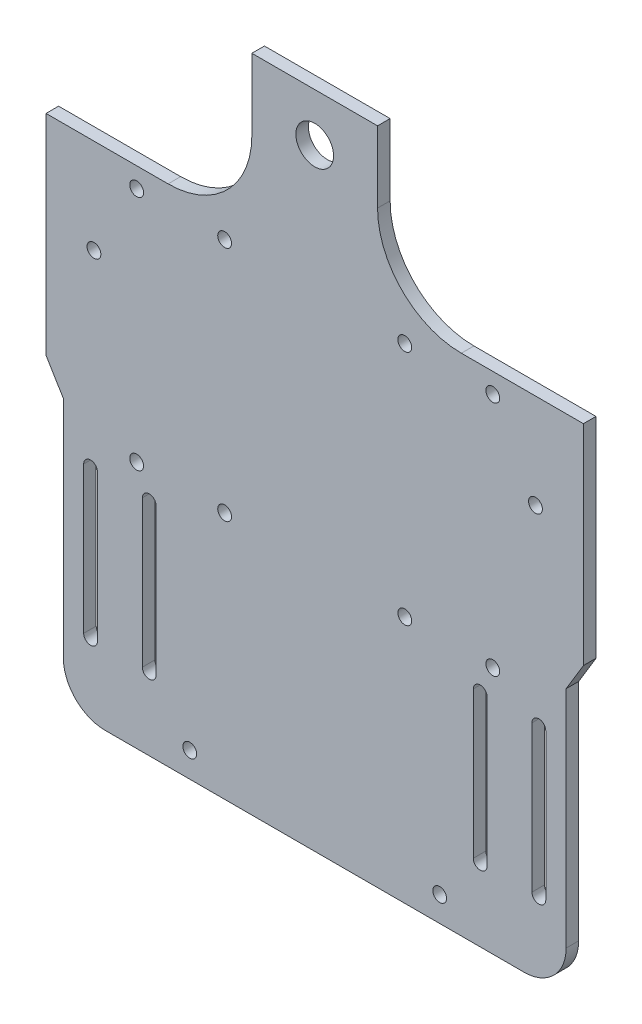
from build123d import *

# Parameters (mm, degrees)
SKETCH1_R           = 4.5
SKETCH1_R_2         = 1.65
BOSS_EXTRUDE1_DEPTH = 3
FILLET3_R           = 20
FILLET4_R           = 10


with BuildPart() as part:
    # Sketch1 → Boss-Extrude1 (new body)
    with BuildSketch(Plane.XY):
        Polygon((402.495772407, 1683.241435849), (402.495772407, 1633.241435849), (406.628072987, 1626.391319652), (406.628072987, 1562.767892621), (526.628072987, 1562.767892621), (526.628072987, 1626.391319652), (530.760373568, 1633.241435849), (530.760373568, 1683.241435849), (481.628072987, 1683.241435849), (481.628072987, 1720.241435849), (451.628072987, 1720.241435849), (451.628072987, 1683.241435849), align=None)
        with Locations((466.628072987, 1708.767892621)):
            Circle(SKETCH1_R, mode=Mode.SUBTRACT)
        with Locations((519.320878863, 1660.655786173)):
            Circle(SKETCH1_R_2, mode=Mode.SUBTRACT)
        with Locations((496.449751686, 1568.767892621)):
            Circle(SKETCH1_R_2, mode=Mode.SUBTRACT)
        with Locations(Location((413.935267112, 1660.655786173, 0), (0, 0, 180))):
            Circle(SKETCH1_R_2, mode=Mode.SUBTRACT)
        with Locations(Location((436.806394289, 1568.767892621, 0), (0, 0, 180))):
            Circle(SKETCH1_R_2, mode=Mode.SUBTRACT)
        with Locations((488.128072987, 1678.491435849)):
            Circle(SKETCH1_R_2, mode=Mode.SUBTRACT)
        with Locations(Location((509.128072987, 1678.491435849, 0), (0, 0, 180))):
            Circle(SKETCH1_R_2, mode=Mode.SUBTRACT)
        with Locations(Location((488.128072987, 1621.991435849, 0), (0, 0, 180))):
            Circle(SKETCH1_R_2, mode=Mode.SUBTRACT)
        with Locations((509.128072987, 1621.991435849)):
            Circle(SKETCH1_R_2, mode=Mode.SUBTRACT)
        with Locations(Location((424.128072987, 1621.991435849, 0), (0, 0, 180))):
            Circle(SKETCH1_R_2, mode=Mode.SUBTRACT)
        with Locations((424.128072987, 1678.491435849)):
            Circle(SKETCH1_R_2, mode=Mode.SUBTRACT)
        with Locations(Location((445.128072987, 1678.491435849, 0), (0, 0, 180))):
            Circle(SKETCH1_R_2, mode=Mode.SUBTRACT)
        with Locations((445.128072987, 1621.991435849)):
            Circle(SKETCH1_R_2, mode=Mode.SUBTRACT)
        with BuildLine():
            Line((414.778072987, 1615.267892621), (414.778072987, 1580.267892621))
            ThreePointArc((414.778072987, 1580.267892621), (413.128072987, 1578.617892621), (411.478072987, 1580.267892621))
            Line((411.478072987, 1580.267892621), (411.478072987, 1615.267892621))
            ThreePointArc((411.478072987, 1615.267892621), (413.128072987, 1616.917892621), (414.778072987, 1615.267892621))
        make_face(mode=Mode.SUBTRACT)
        with BuildLine():
            Line((518.478072987, 1615.267892621), (518.478072987, 1580.267892621))
            ThreePointArc((518.478072987, 1580.267892621), (520.128072987, 1578.617892621), (521.778072987, 1580.267892621))
            Line((521.778072987, 1580.267892621), (521.778072987, 1615.267892621))
            ThreePointArc((521.778072987, 1615.267892621), (520.128072987, 1616.917892621), (518.478072987, 1615.267892621))
        make_face(mode=Mode.SUBTRACT)
        with BuildLine():
            Line((428.778072987, 1615.267892621), (428.778072987, 1580.267892621))
            ThreePointArc((428.778072987, 1580.267892621), (427.128072987, 1578.617892621), (425.478072987, 1580.267892621))
            Line((425.478072987, 1580.267892621), (425.478072987, 1615.267892621))
            ThreePointArc((425.478072987, 1615.267892621), (427.128072987, 1616.917892621), (428.778072987, 1615.267892621))
        make_face(mode=Mode.SUBTRACT)
        with BuildLine():
            Line((504.478072987, 1615.267892621), (504.478072987, 1580.267892621))
            ThreePointArc((504.478072987, 1580.267892621), (506.128072987, 1578.617892621), (507.778072987, 1580.267892621))
            Line((507.778072987, 1580.267892621), (507.778072987, 1615.267892621))
            ThreePointArc((507.778072987, 1615.267892621), (506.128072987, 1616.917892621), (504.478072987, 1615.267892621))
        make_face(mode=Mode.SUBTRACT)
    extrude(amount=BOSS_EXTRUDE1_DEPTH)

    # Fillet3
    fillet3_edges = [part.edges().sort_by_distance(p)[0] for p in [
        (481.628072987, 1683.241435849, 1.5),
        (451.628072987, 1683.241435849, 1.5),
    ]]
    fillet(fillet3_edges, radius=FILLET3_R)

    # Fillet4
    fillet4_edges = [part.edges().sort_by_distance(p)[0] for p in [
        (526.628072987, 1562.767892621, 1.5),
        (406.628072987, 1562.767892621, 1.5),
    ]]
    fillet(fillet4_edges, radius=FILLET4_R)


solid = part.part
